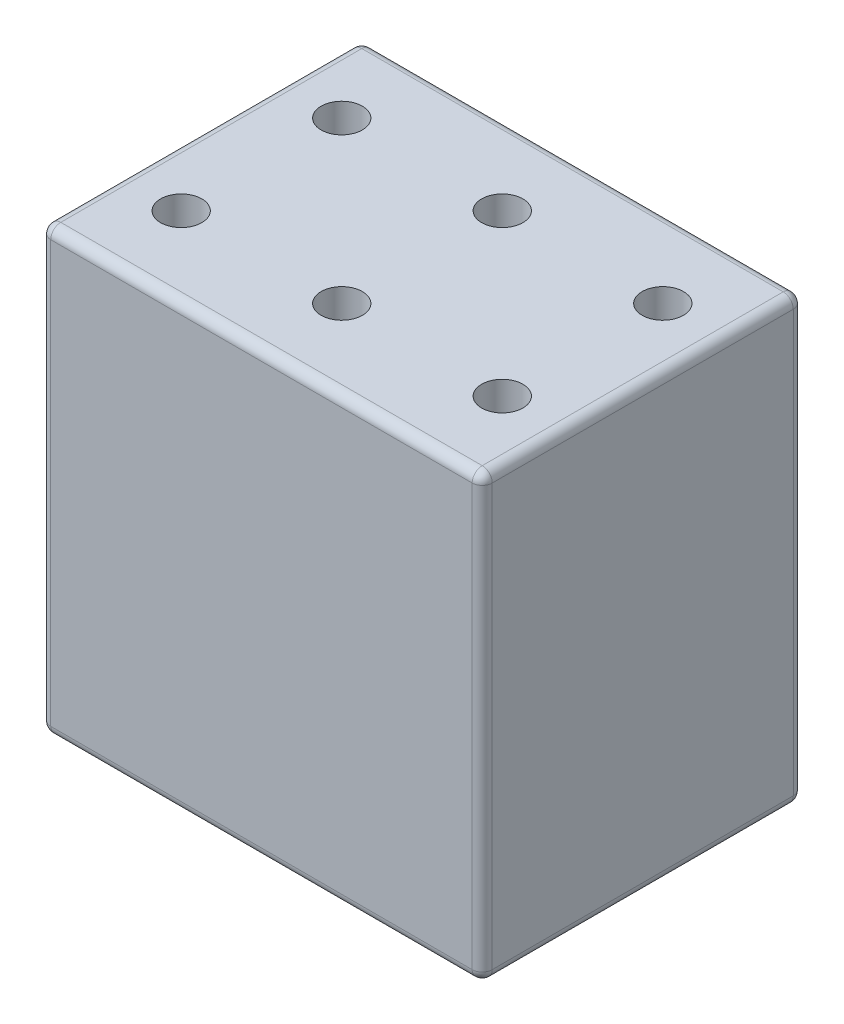
from build123d import *

# Parameters (mm, degrees)
SKETCH1_W           = 69.85
SKETCH1_H           = 50.8
SKETCH1_R           = 3.2639
BOSS_EXTRUDE1_DEPTH = 69.85
FILLET1_R           = 1.5875


with BuildPart() as part:
    # Sketch1 → Boss-Extrude1 (new body)
    with BuildSketch(Plane(origin=(0, 0, 0), x_dir=(1, 0, 0), z_dir=(0, 1, 0))):
        Rectangle(SKETCH1_W, SKETCH1_H)
        with Locations(Location((-25.4, -12.7, 0), (0, 0, 270))):
            Circle(SKETCH1_R, mode=Mode.SUBTRACT)
        with Locations(Location((0, -12.7, 0), (0, 0, 270))):
            Circle(SKETCH1_R, mode=Mode.SUBTRACT)
        with Locations(Location((25.4, -12.7, 0), (0, 0, 270))):
            Circle(SKETCH1_R, mode=Mode.SUBTRACT)
        with Locations(Location((0, 12.7, 0), (0, 0, 270))):
            Circle(SKETCH1_R, mode=Mode.SUBTRACT)
        with Locations(Location((25.4, 12.7, 0), (0, 0, 270))):
            Circle(SKETCH1_R, mode=Mode.SUBTRACT)
        with Locations(Location((-25.4, 12.7, 0), (0, 0, 270))):
            Circle(SKETCH1_R, mode=Mode.SUBTRACT)
    extrude(amount=BOSS_EXTRUDE1_DEPTH)

    # Fillet1
    fillet1_edges = [part.edges().sort_by_distance(p)[0] for p in [
        (-34.925, 69.85, 0),
        (0, 69.85, 25.4),
        (34.925, 69.85, 0),
        (0, 0, 25.4),
        (-34.925, 0, 0),
        (0, 0, -25.4),
        (34.925, 0, 0),
        (34.925, 34.925, 25.4),
        (-34.925, 34.925, 25.4),
        (-34.925, 34.925, -25.4),
        (34.925, 34.925, -25.4),
        (0, 69.85, -25.4),
    ]]
    fillet(fillet1_edges, radius=FILLET1_R)


solid = part.part
